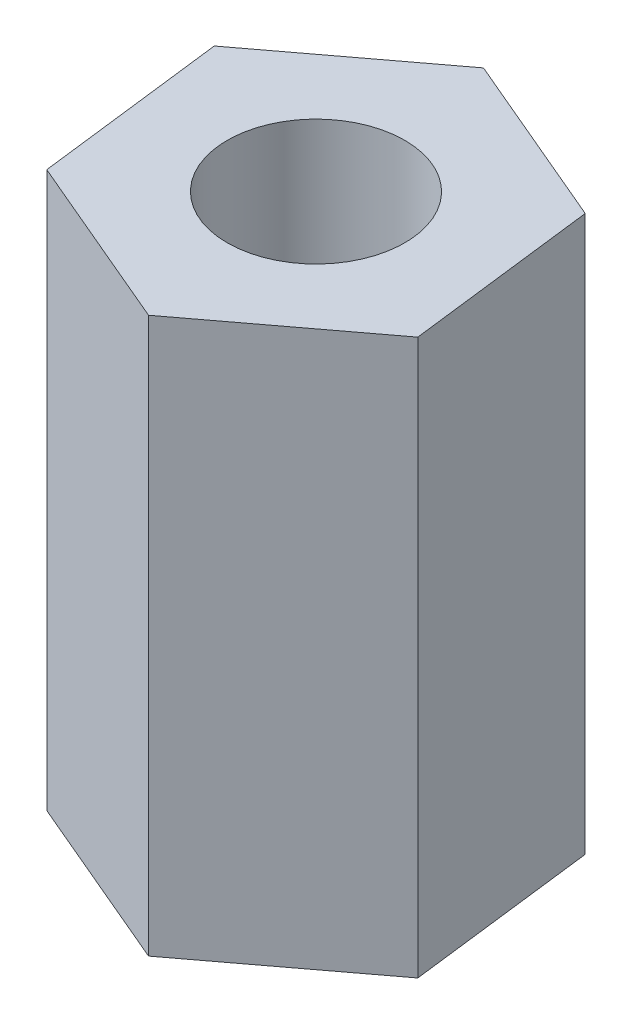
from build123d import *

# Parameters (mm, degrees)
SKETCH_1_R      = 1.6
EXTRUDE_1_DEPTH = 10


with BuildPart() as part:
    # 草图1 → 凸台-拉伸1 (new body)
    with BuildSketch(Plane(origin=(0, 0, 0), x_dir=(1, 0, 0), z_dir=(0, 1, 0))):
        Polygon((2.767176381, 2.083922954), (-0.421142027, 3.438406519), (-3.188318408, 1.354483566), (-2.767176381, -2.083922954), (0.421142027, -3.438406519), (3.188318408, -1.354483566), align=None)
        with Locations(Location((0, 0, 0), (0, 0, 270))):
            Circle(SKETCH_1_R, mode=Mode.SUBTRACT)
    extrude(amount=EXTRUDE_1_DEPTH)


solid = part.part
